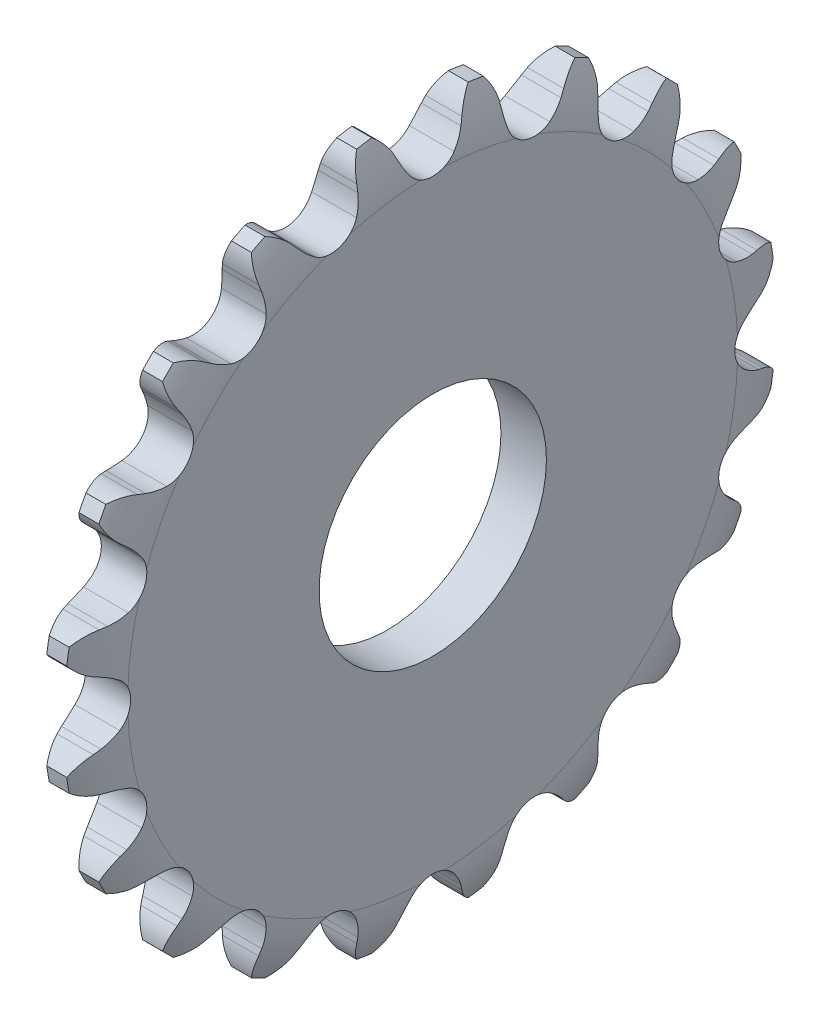
from build123d import *

# Parameters (mm, degrees)
TOOTHCUT_DEPTH        = 32.169679271
TEETHCUTS_COUNT       = 20
TEETHCUTS_ANGLE       = 342
BORSKE_R              = 6.35
BORE_DEPTH            = 50.8000508
BORE_14_MM_DEPTH      = 31.885593056
BORE_14_MM_DEPTH_BACK = 31.885593056
SKETCH1_R             = 7


with BuildPart() as part:
    # BasProSke → Base-Revolve (revolve)
    with BuildSketch(Plane(origin=(0, 0, 0), x_dir=(1, 0, 0), z_dir=(0, 1, 0)), mode=Mode.PRIVATE) as base_revolve_sk:
        with BuildLine():
            Line((0, 0), (0, 18.776161082))
            ThreePointArc((0, 18.776161082), (0.199787117, 20.411751477), (0.7874, 21.951161082))
            Line((0.7874, 21.951161082), (2.01295, 21.951161082))
            ThreePointArc((2.01295, 21.951161082), (2.600562883, 20.411751477), (2.80035, 18.776161082))
            Line((2.80035, 18.776161082), (2.80035, 0))
            Line((2.80035, 0), (0, 0))
        make_face()
    revolve(base_revolve_sk.sketch.rotate(Axis((-10, 0, 0), (1, 0, 0)), 180), axis=Axis((-10, 0, 0), (1, 0, 0)))

    # TooCutSke → ToothCut (cut, through all)
    with BuildSketch(Plane(origin=(0, 0, 0), x_dir=(0, 0, -1), z_dir=(1, 0, 0))):
        with BuildLine():
            Line((1.918313524, 20.240957663), (2.077231161, 20.619007781))
            ThreePointArc((2.077231161, 20.619007781), (3.071954195, 21.821421376), (4.565885661, 22.272465878))
            ThreePointArc((4.565885661, 22.272465878), (0, 22.735655877), (-4.565885661, 22.272465878))
            ThreePointArc((-4.565885661, 22.272465878), (-3.071954195, 21.821421376), (-2.077231161, 20.619007781))
            Line((-2.077231161, 20.619007781), (-1.918313524, 20.240957663))
            ThreePointArc((-1.918313524, 20.240957663), (-1.660798791, 19.726712623), (-1.337533993, 19.251042918))
            ThreePointArc((-1.337533993, 19.251042918), (0, 18.598684001), (1.337533993, 19.251042918))
            ThreePointArc((1.337533993, 19.251042918), (1.660798791, 19.726712623), (1.918313524, 20.240957663))
        make_face()
    toothcut = extrude(amount=TOOTHCUT_DEPTH, mode=Mode.SUBTRACT)

    # TeethCuts: ToothCut ×20 about axis
    teethcuts_axis = Axis((-10, 0, 0), (1, 0, 0))
    for i in range(1, TEETHCUTS_COUNT):
        add(toothcut.rotate(teethcuts_axis, i * TEETHCUTS_ANGLE / (TEETHCUTS_COUNT - 1)), mode=Mode.SUBTRACT)

    # BorSke → Bore (cut, symmetric)
    with BuildSketch(Plane(origin=(0, 0, 0), x_dir=(0, 0, -1), z_dir=(1, 0, 0))):
        with Locations(Location((0, 0, 0), (0, 0, 180))):
            Circle(BORSKE_R)
    extrude(amount=BORE_DEPTH, both=True, mode=Mode.SUBTRACT)

    # Sketch1 → Bore 14 mm (cut, two sides: drawn at the far end of the back side and taken through both)
    with BuildSketch(Plane(origin=(0, 0, 0), x_dir=(0, 0, -1), z_dir=(1, 0, 0)).offset(-BORE_14_MM_DEPTH_BACK)):
        Circle(SKETCH1_R)
    extrude(amount=BORE_14_MM_DEPTH + BORE_14_MM_DEPTH_BACK, mode=Mode.SUBTRACT)


solid = part.part
